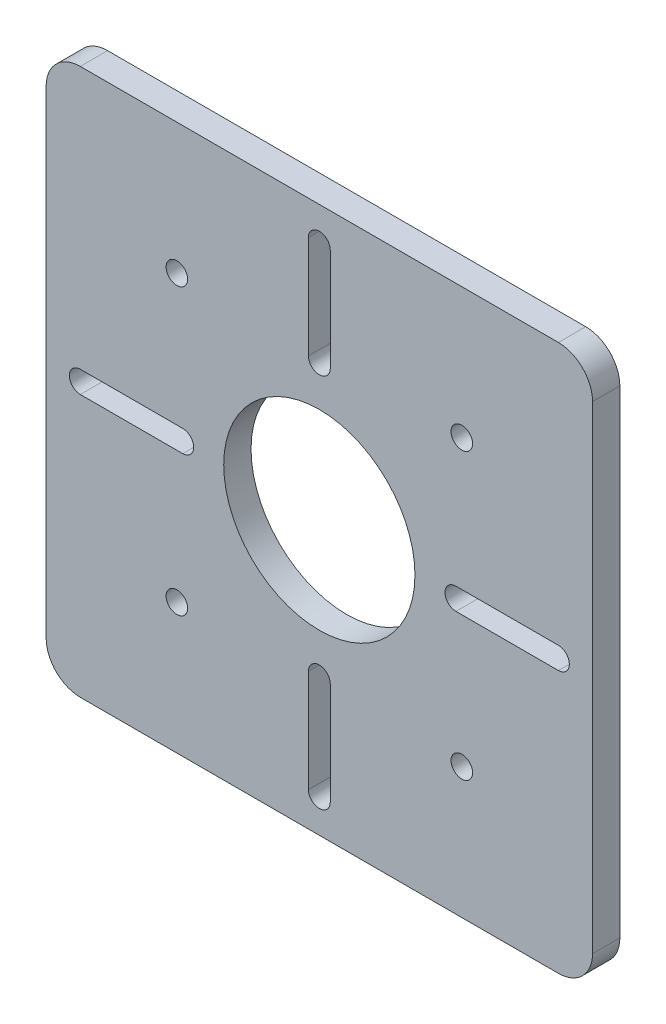
from build123d import *

# Parameters (mm, degrees)
SKETCH2_W           = 80
SKETCH2_H           = 80
SKETCH2_R           = 1.575
BOSS_EXTRUDE1_DEPTH = 4
FILLET1_R           = 5


with BuildPart() as part:
    # Sketch2 → Boss-Extrude1 (new body)
    with BuildSketch(Plane.XY):
        Rectangle(SKETCH2_W, SKETCH2_H)
        with Locations((-20.859650045, -20.859650045)):
            Circle(SKETCH2_R, mode=Mode.SUBTRACT)
        with Locations((-20.859650045, 20.859650045)):
            Circle(SKETCH2_R, mode=Mode.SUBTRACT)
        with Locations((20.859650045, 20.859650045)):
            Circle(SKETCH2_R, mode=Mode.SUBTRACT)
        with Locations((20.859650045, -20.859650045)):
            Circle(SKETCH2_R, mode=Mode.SUBTRACT)
        with BuildLine():
            Line((1.6, 20), (1.6, 35))
            ThreePointArc((1.6, 35), (1.13137085, 36.13137085), (0, 36.6))
            ThreePointArc((0, 36.6), (-1.13137085, 36.13137085), (-1.6, 35))
            Line((-1.6, 35), (-1.6, 20))
            ThreePointArc((-1.6, 20), (0, 18.4), (1.6, 20))
        make_face(mode=Mode.SUBTRACT)
        with BuildLine():
            Line((1.6, -35), (1.6, -20))
            ThreePointArc((1.6, -20), (1.13137085, -18.86862915), (0, -18.4))
            ThreePointArc((0, -18.4), (-1.13137085, -18.86862915), (-1.6, -20))
            Line((-1.6, -20), (-1.6, -35))
            ThreePointArc((-1.6, -35), (0, -36.6), (1.6, -35))
        make_face(mode=Mode.SUBTRACT)
        with BuildLine():
            Line((20, -1.6), (35, -1.6))
            ThreePointArc((35, -1.6), (36.6, 0), (35, 1.6))
            Line((35, 1.6), (20, 1.6))
            ThreePointArc((20, 1.6), (18.4, 0), (20, -1.6))
        make_face(mode=Mode.SUBTRACT)
        with BuildLine():
            Line((-35, -1.6), (-20, -1.6))
            ThreePointArc((-20, -1.6), (-18.4, 0), (-20, 1.6))
            Line((-20, 1.6), (-35, 1.6))
            ThreePointArc((-35, 1.6), (-36.6, 0), (-35, -1.6))
        make_face(mode=Mode.SUBTRACT)
        with BuildLine():
            ThreePointArc((0, -14), (14, 0), (0, 14))
            ThreePointArc((0, 14), (-14, 0), (0, -14))
        make_face(mode=Mode.SUBTRACT)
    extrude(amount=BOSS_EXTRUDE1_DEPTH)

    # Fillet1
    fillet1_edges = [part.edges().sort_by_distance(p)[0] for p in [
        (40, -40, 2),
        (-40, -40, 2),
        (-40, 40, 2),
        (40, 40, 2),
    ]]
    fillet(fillet1_edges, radius=FILLET1_R)


solid = part.part
